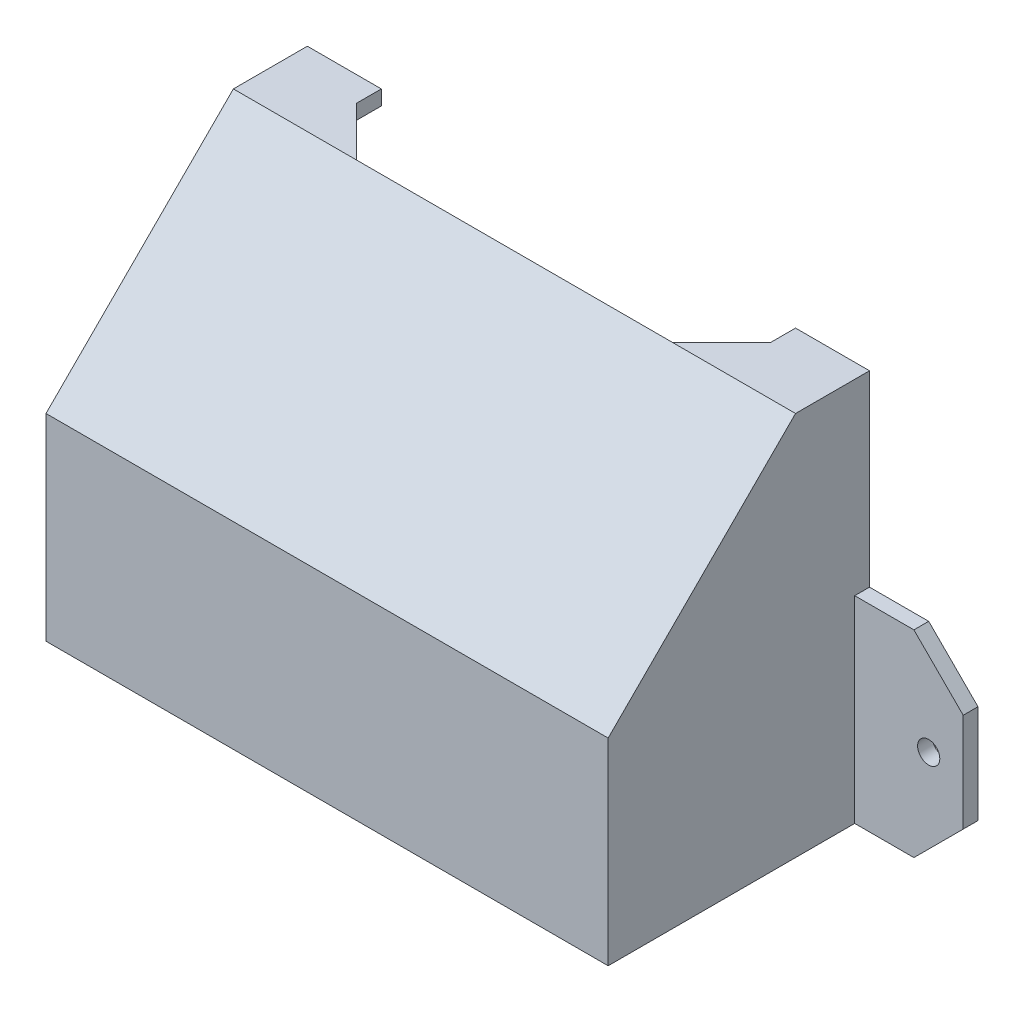
from build123d import *

# Parameters (mm, degrees)
BOSS_EXTRUDE1_DEPTH     = 40
BOSS_EXTRUDE2_DEPTH     = 3
EXTRUDE_THIN1_DEPTH     = 108
CUT_EXTRUDE1_DEPTH      = 124.020323524
CUT_EXTRUDE1_DEPTH_BACK = 12
CHAMFER1_SIZE           = 10
SKETCH5_R               = 2.25
CUT_EXTRUDE2_DEPTH      = 3


with BuildPart() as part:
    # Sketch1 → Boss-Extrude1 (new body)
    with BuildSketch(Plane(origin=(0, 0, 0), x_dir=(1, 0, 0), z_dir=(0, 1, 0))):
        Polygon((-54, 0), (-54, -50), (54, -50), (54, 0), (57, 0), (79, 0), (79, -3), (57, -3), (57, -53), (-57, -53), (-57, -3), (-79, -3), (-79, 0), (-57, 0), align=None)
    extrude(amount=BOSS_EXTRUDE1_DEPTH)

    # Sketch2 → Boss-Extrude2 (add)
    with BuildSketch(Plane.ZY.offset(57)):
        Polygon((53, 40), (15, 78), (0, 78), (0, 40), align=None)
    boss_extrude2 = extrude(amount=-BOSS_EXTRUDE2_DEPTH)

    # Mirror1: Boss-Extrude2 across plane
    add(boss_extrude2.mirror(Plane(origin=(0, 0, 0), x_dir=(0, 0, 1), z_dir=(1, 0, 0))))

    # Sketch3 → Extrude-Thin1 (add)
    with BuildSketch(Plane.ZY.offset(-54)):
        Polygon((0, 78), (15, 78), (53, 40), (50.878679656, 37.878679656), (13.757359313, 75), (0, 75), align=None)
    extrude(amount=EXTRUDE_THIN1_DEPTH)

    # Sketch4 → Cut-Extrude1 (cut, two sides: drawn at the far end of the back side and taken through both)
    with BuildSketch(Plane(origin=(0, 78, 0), x_dir=(1, 0, 0), z_dir=(0, 1, 0)).offset(-CUT_EXTRUDE1_DEPTH_BACK)):
        Polygon((-42, 274.196896272), (-42, 0), (-42, -5), (-32, -15), (32, -15), (42, -5), (42, 0), (42, 274.196896272), (42, 822.590688817), (-42, 822.590688817), align=None)
    extrude(amount=CUT_EXTRUDE1_DEPTH + CUT_EXTRUDE1_DEPTH_BACK, mode=Mode.SUBTRACT)

    # Chamfer1
    chamfer1_edges = [part.edges().sort_by_distance(p)[0] for p in [
        (-79, 40, 1.5),
        (79, 0, 1.5),
        (-79, 0, 1.5),
        (79, 40, 1.5),
    ]]
    chamfer(chamfer1_edges, length=CHAMFER1_SIZE)

    # Sketch5 → Cut-Extrude2 (cut)
    with BuildSketch(Plane.XY.offset(3)):
        with Locations((-72, 20)):
            Circle(SKETCH5_R)
    cut_extrude2 = extrude(amount=-CUT_EXTRUDE2_DEPTH, mode=Mode.SUBTRACT)

    # Mirror2: Cut-Extrude2 across plane
    add(cut_extrude2.mirror(Plane(origin=(0, 0, 0), x_dir=(0, 0, 1), z_dir=(1, 0, 0))), mode=Mode.SUBTRACT)


solid = part.part
